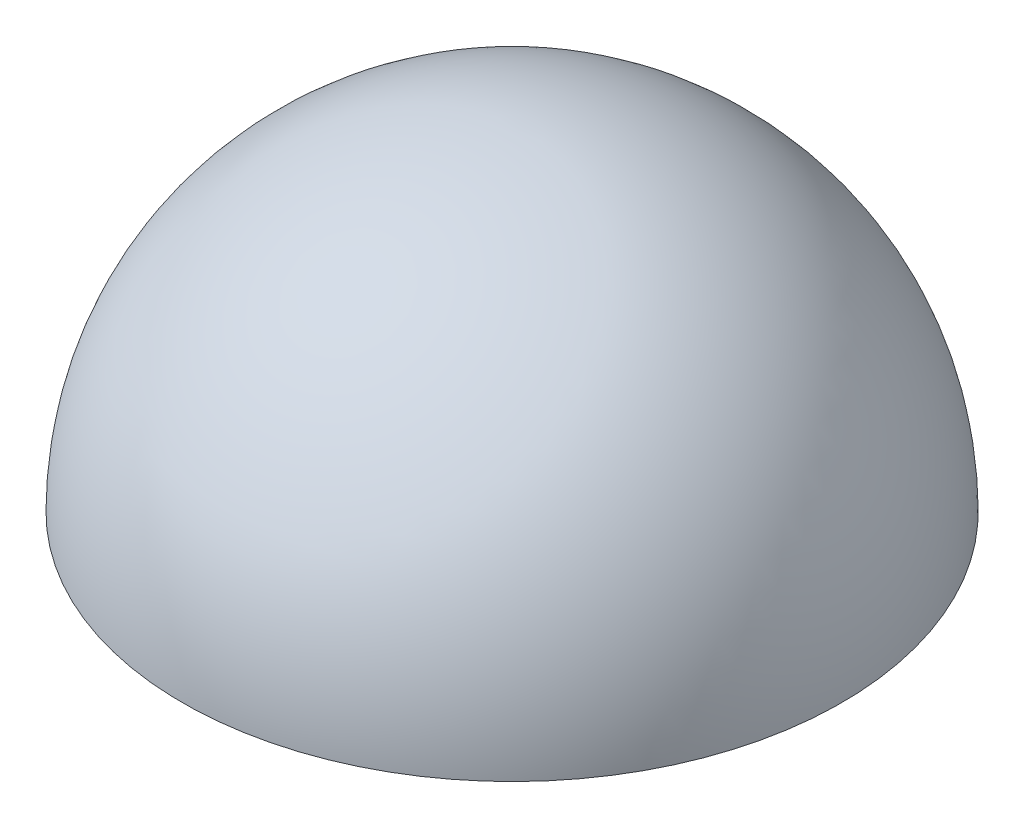
from build123d import *

# Parameters (mm, degrees)
REVOLVE2_ANGLE = 180


with BuildPart() as part:
    # Sketch1 → Revolve2 (revolve)
    with BuildSketch(Plane(origin=(0, 0, 0), x_dir=(1, 0, 0), z_dir=(0, 1, 0))):
        with BuildLine():
            Line((-4, 0), (-6, 0))
            ThreePointArc((-6, 0), (0, 6), (6, 0))
            Line((6, 0), (4, 0))
            ThreePointArc((4, 0), (0, 4), (-4, 0))
        make_face()
    revolve(axis=Axis((-55, 0, 0), (1, 0, 0)), revolution_arc=REVOLVE2_ANGLE)


solid = part.part
